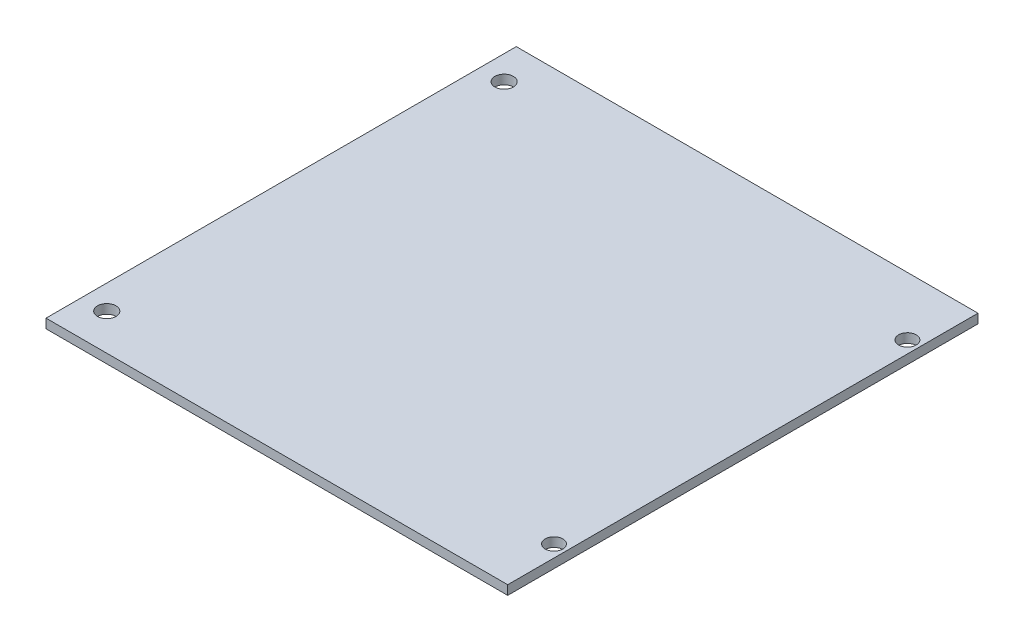
from build123d import *

# Parameters (mm, degrees)
SKETCH1_W           = 79.799999912
SKETCH1_H           = 81.28
BOSS_EXTRUDE1_DEPTH = 1.600000102
SKETCH2_R           = 1.524
CUT_EXTRUDE1_DEPTH  = 107.841239355
SKETCH4_R           = 1.6
CUT_EXTRUDE2_DEPTH  = 107.841239355


with BuildPart() as part:
    # Sketch1 → Boss-Extrude1 (new body)
    with BuildSketch(Plane(origin=(0, 0, 0), x_dir=(1, 0, 0), z_dir=(0, 1, 0))):
        with Locations((-31.957523467, -38.410532915)):
            Rectangle(SKETCH1_W, SKETCH1_H)
    extrude(amount=BOSS_EXTRUDE1_DEPTH)

    # Sketch2 → Cut-Extrude1 (cut, through all)
    with BuildSketch(Plane(origin=(0, 1.600000102, 0), x_dir=(1, 0, 0), z_dir=(0, 1, 0))):
        with Locations(Location((5.842476489, -68.950532915, 0), (0, 0, 270))):
            Circle(SKETCH2_R)
    cut_extrude1 = extrude(amount=-CUT_EXTRUDE1_DEPTH, mode=Mode.SUBTRACT)

    # Mirror1: Cut-Extrude1 across plane
    add(cut_extrude1.mirror(Plane.XY.offset(38.410532915)), mode=Mode.SUBTRACT)

    # Sketch4 → Cut-Extrude2 (cut, through all)
    with BuildSketch(Plane.XZ):
        with Locations(Location((-67.657528223, 72.750532915, 0), (0, 0, 270))):
            Circle(SKETCH4_R)
    cut_extrude2 = extrude(amount=-CUT_EXTRUDE2_DEPTH, mode=Mode.SUBTRACT)

    # Mirror2: Cut-Extrude2 across plane
    add(cut_extrude2.mirror(Plane.XY.offset(38.410532915)), mode=Mode.SUBTRACT)


solid = part.part
